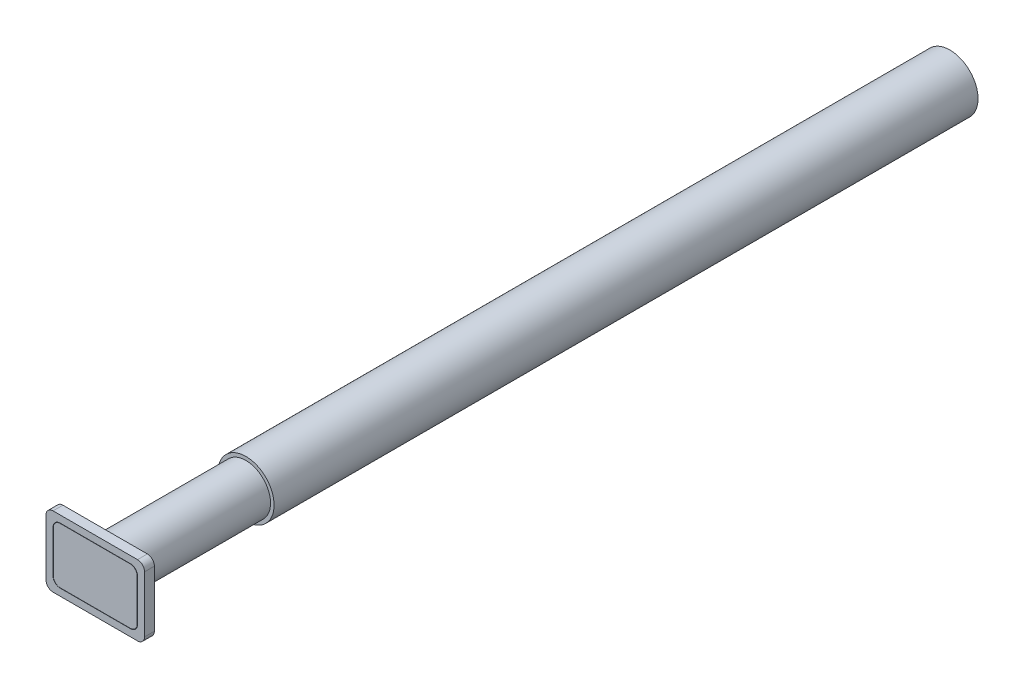
from build123d import *

# Parameters (mm, degrees)
SKETCH1_R           = 25.4
BOSS_EXTRUDE1_DEPTH = 635
SKETCH2_R           = 22.225
BOSS_EXTRUDE2_DEPTH = 127
BOSS_EXTRUDE3_DEPTH = 8.89
CUT_EXTRUDE1_DEPTH  = 6.35
BOSS_EXTRUDE5_DEPTH = 6.096


with BuildPart() as part:
    # Sketch1 → Boss-Extrude1 (new body)
    with BuildSketch(Plane.XY):
        with Locations(Location((0, 0, 0), (0, 0, 180))):
            Circle(SKETCH1_R)
    extrude(amount=BOSS_EXTRUDE1_DEPTH)

    # Sketch2 → Boss-Extrude2 (add)
    with BuildSketch(Plane.XY.offset(635)):
        Circle(SKETCH2_R)
    extrude(amount=BOSS_EXTRUDE2_DEPTH)

    # Sketch3 → Boss-Extrude3 (add)
    with BuildSketch(Plane.XY.offset(762)):
        with BuildLine():
            Line((-38.1, 31.75), (38.1, 31.75))
            ThreePointArc((38.1, 31.75), (42.590128061, 29.890128061), (44.45, 25.4))
            Line((44.45, 25.4), (44.45, -25.4))
            ThreePointArc((44.45, -25.4), (42.590128061, -29.890128061), (38.1, -31.75))
            Line((38.1, -31.75), (-38.1, -31.75))
            ThreePointArc((-38.1, -31.75), (-42.590128061, -29.890128061), (-44.45, -25.4))
            Line((-44.45, -25.4), (-44.45, 25.4))
            ThreePointArc((-44.45, 25.4), (-42.590128061, 29.890128061), (-38.1, 31.75))
        make_face()
    extrude(amount=BOSS_EXTRUDE3_DEPTH)

    # Sketch4 → Cut-Extrude1 (cut)
    with BuildSketch(Plane.XY.offset(770.89)):
        with BuildLine():
            Line((-31.75, -25.4), (31.75, -25.4))
            ThreePointArc((31.75, -25.4), (36.240128061, -23.540128061), (38.1, -19.05))
            Line((38.1, -19.05), (38.1, 19.05))
            ThreePointArc((38.1, 19.05), (36.240128061, 23.540128061), (31.75, 25.4))
            Line((31.75, 25.4), (-31.75, 25.4))
            ThreePointArc((-31.75, 25.4), (-36.240128061, 23.540128061), (-38.1, 19.05))
            Line((-38.1, 19.05), (-38.1, -19.05))
            ThreePointArc((-38.1, -19.05), (-36.240128061, -23.540128061), (-31.75, -25.4))
        make_face()
    extrude(amount=-CUT_EXTRUDE1_DEPTH, mode=Mode.SUBTRACT)


with BuildPart() as body_2:
    # Sketch5 → Boss-Extrude5 (new body)
    with BuildSketch(Plane.XY.offset(764.794)):
        with BuildLine():
            Line((-31.496, 25.146), (31.496, 25.146))
            ThreePointArc((31.496, 25.146), (35.986128061, 23.286128061), (37.846, 18.796))
            Line((37.846, 18.796), (37.846, -18.796))
            ThreePointArc((37.846, -18.796), (35.986128061, -23.286128061), (31.496, -25.146))
            Line((31.496, -25.146), (-31.496, -25.146))
            ThreePointArc((-31.496, -25.146), (-35.986128061, -23.286128061), (-37.846, -18.796))
            Line((-37.846, -18.796), (-37.846, 18.796))
            ThreePointArc((-37.846, 18.796), (-35.986128061, 23.286128061), (-31.496, 25.146))
        make_face()
    extrude(amount=BOSS_EXTRUDE5_DEPTH)


solid = Compound([part.part, body_2.part])
